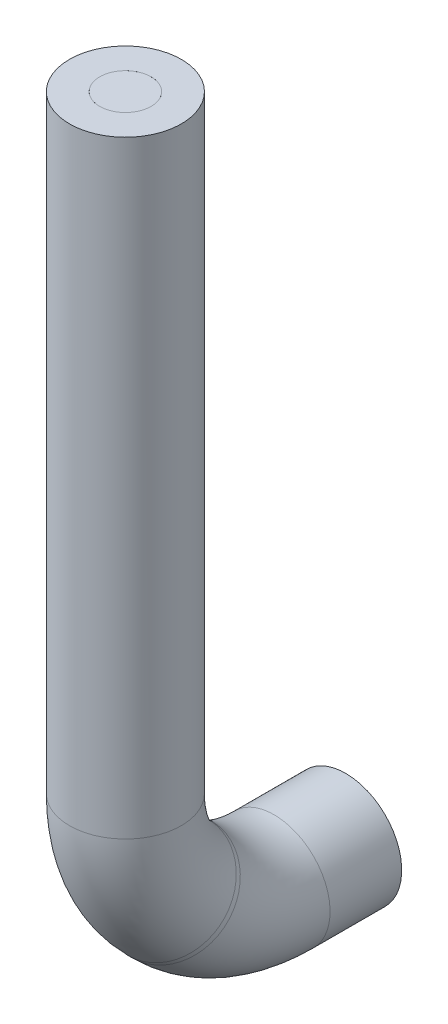
from build123d import *

# Parameters (mm, degrees)
SKETCH_2_R   = 0.39
SKETCH_3_R   = 0.85
SKETCH_3_R_2 = 0.39


with BuildPart() as part:
    # По траектории1: sweep along a path in Эскиз1
    with BuildLine(Plane(origin=(0, 0, 0), x_dir=(0, 0, -1), z_dir=(1, 0, 0))) as sweep_1_path:
        Line((0, 11.49999984), (0, 2.26126984))
        ThreePointArc((0, 2.26126984), (0.167465028, 1.419366289), (0.644365081, 0.705634921))
        Line((0.644365081, 0.705634921), (0.705634921, 0.644365081))
        ThreePointArc((0.705634921, 0.644365081), (1.419366289, 0.167465028), (2.26126984, 0))
        Line((2.26126984, 0), (3.35, 0))
    # Эскиз2 → По траектории1 (sweep)
    with BuildSketch(Plane.XY.offset(-3.35)):
        Circle(SKETCH_2_R)
    sweep(path=sweep_1_path.line)


with BuildPart() as body_2:
    # По траектории2: sweep along a path in Эскиз1<2>
    with BuildLine(Plane(origin=(0, 0, 0), x_dir=(0, 0, -1), z_dir=(1, 0, 0))) as sweep_2_path:
        Line((0, 11.49999984), (0, 2.26126984))
        ThreePointArc((0, 2.26126984), (0.167465028, 1.419366289), (0.644365081, 0.705634921))
        Line((0.644365081, 0.705634921), (0.705634921, 0.644365081))
        ThreePointArc((0.705634921, 0.644365081), (1.419366289, 0.167465028), (2.26126984, 0))
        Line((2.26126984, 0), (3.35, 0))
    # Эскиз3 → По траектории2 (sweep)
    with BuildSketch(Plane(origin=(0, 0, -3.35), x_dir=(-1, 0, 0), z_dir=(0, 0, -1))):
        Circle(SKETCH_3_R)
        Circle(SKETCH_3_R_2, mode=Mode.SUBTRACT)
    sweep(path=sweep_2_path.line)


solid = Compound([part.part, body_2.part])
